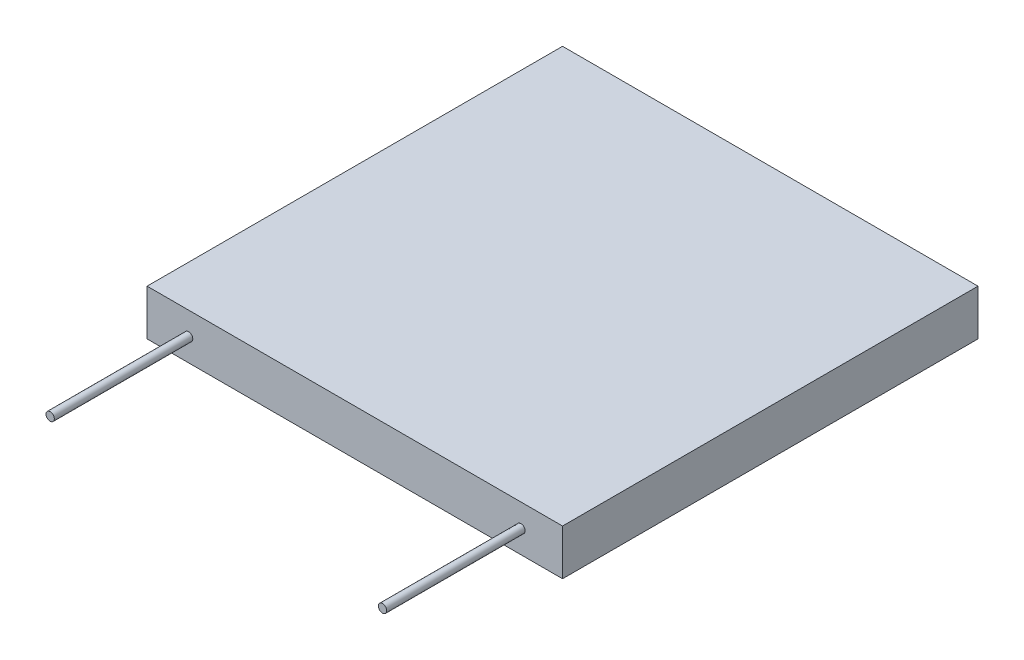
from build123d import *

# Parameters (mm, degrees)
SKETCH_1_W      = 30
SKETCH_1_H      = 30
EXTRUDE_1_DEPTH = 3.3
SKETCH_2_R      = 0.3
EXTRUDE_2_DEPTH = 10


with BuildPart() as part:
    # 草图1 → 拉伸1 (new body)
    with BuildSketch(Plane(origin=(0, 0, 0), x_dir=(1, 0, 0), z_dir=(0, 1, 0))):
        Rectangle(SKETCH_1_W, SKETCH_1_H)
    extrude(amount=EXTRUDE_1_DEPTH)

    # 草图2 → 拉伸2 (add)
    with BuildSketch(Plane.XY.offset(15)):
        with Locations(Location((-12, 1.65, 0), (0, 0, 180))):
            Circle(SKETCH_2_R)
        with Locations(Location((12, 1.65, 0), (0, 0, 180))):
            Circle(SKETCH_2_R)
    extrude(amount=EXTRUDE_2_DEPTH)


solid = part.part
